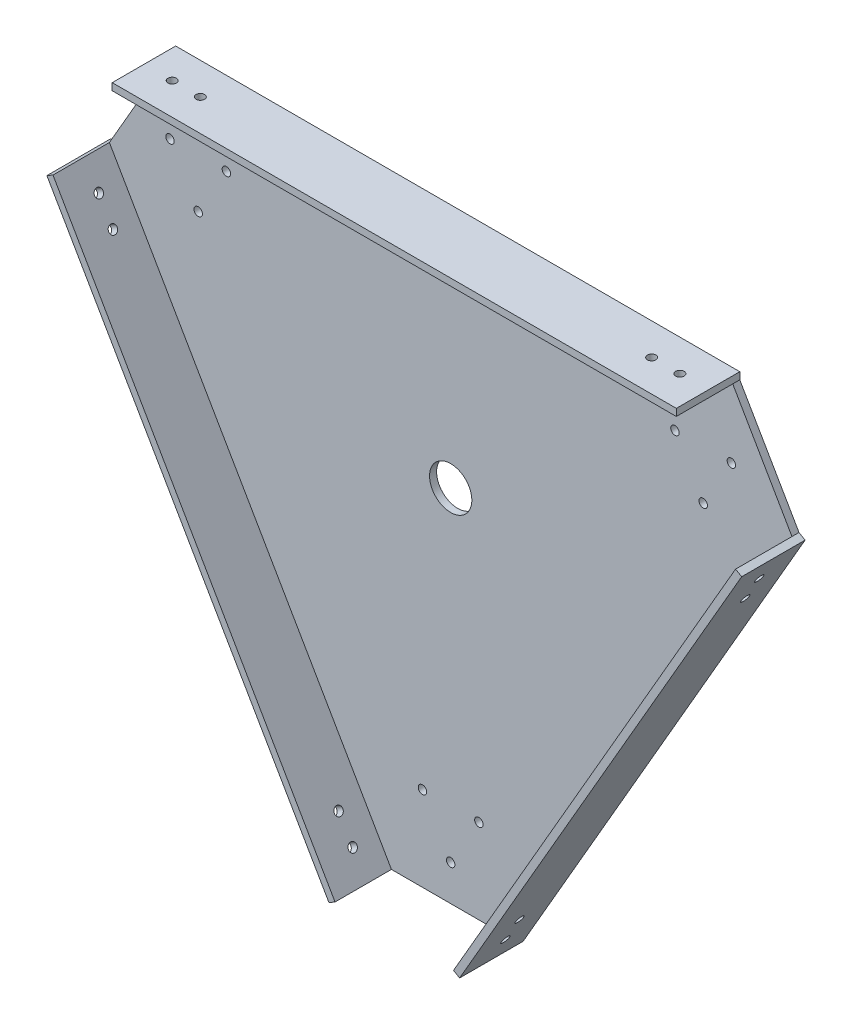
from build123d import *

# Parameters (mm, degrees)
SKETCH_1_R          = 1.5
SKETCH_1_R_2        = 7.5
EXTRUDE_1_DEPTH     = 2.5
SKETCH_2_W          = 200
SKETCH_2_H          = 2.5
EXTRUDE_2_DEPTH     = 22.5
CUT_EXTRUDE_1_REACH = 327.01
SKETCH_3_R          = 1.5
CUT_EXTRUDE_2_REACH = 238.725
SKETCH_6_R          = 1.5
CUT_EXTRUDE_3_REACH = 303.968
SKETCH_7_R          = 1.5


with BuildPart() as part:
    # Эскиз1 → Бобышка-Вытянуть1 (new body)
    with BuildSketch(Plane.XY):
        Polygon((0, 0), (21, 36.373066959), (221, 36.373066959), (242, 0), (142, -173.205080757), (100, -173.205080757), align=None)
        with Locations((21.48120212, 11.846533479)):
            Circle(SKETCH_1_R, mode=Mode.SUBTRACT)
        with Locations((41.48120212, 11.846533479)):
            Circle(SKETCH_1_R, mode=Mode.SUBTRACT)
        with Locations((31.48120212, -5.473974596)):
            Circle(SKETCH_1_R, mode=Mode.SUBTRACT)
        with Locations((200.51879788, 11.846533479)):
            Circle(SKETCH_1_R, mode=Mode.SUBTRACT)
        with Locations((220.51879788, 11.846533479)):
            Circle(SKETCH_1_R, mode=Mode.SUBTRACT)
        with Locations((210.51879788, -5.473974596)):
            Circle(SKETCH_1_R, mode=Mode.SUBTRACT)
        with Locations((111, -143.204572681)):
            Circle(SKETCH_1_R, mode=Mode.SUBTRACT)
        with Locations((131, -143.204572681)):
            Circle(SKETCH_1_R, mode=Mode.SUBTRACT)
        with Locations((121, -160.525080757)):
            Circle(SKETCH_1_R, mode=Mode.SUBTRACT)
        with Locations((121, -45.610671266)):
            Circle(SKETCH_1_R_2, mode=Mode.SUBTRACT)
    extrude(amount=EXTRUDE_1_DEPTH)

    # Эскиз2 → Бобышка-Вытянуть2 (add)
    with BuildSketch(Plane(origin=(0, 0, 0), x_dir=(-1, 0, 0), z_dir=(0, 0, -1))):
        Polygon((0, 0), (2.165063509, -1.25), (-97.834936491, -174.455080757), (-100, -173.205080757), align=None)
        with Locations((-121, 37.623066959)):
            Rectangle(SKETCH_2_W, SKETCH_2_H)
        Polygon((-242, 0), (-244.165063509, -1.25), (-144.165063509, -174.455080757), (-142, -173.205080757), align=None)
    extrude(amount=-EXTRUDE_2_DEPTH)

    # Эскиз3 → Вырез-Вытянуть1 (cut, up to next)
    with BuildSketch(Plane(origin=(0, 38.873066959, 0), x_dir=(1, 0, 0), z_dir=(0, 1, 0)), mode=Mode.PRIVATE) as cut_extrude_1_sk1:
        with Locations(Location((211, -11.25, 0), (0, 0, 180))):
            Circle(SKETCH_3_R)
    cut_extrude_1_tool1 = extrude(cut_extrude_1_sk1.sketch, amount=-CUT_EXTRUDE_1_REACH, mode=Mode.PRIVATE) & part.part
    # Эскиз3 → Вырез-Вытянуть1 (cut, up to next)
    with BuildSketch(Plane(origin=(0, 38.873066959, 0), x_dir=(1, 0, 0), z_dir=(0, 1, 0)), mode=Mode.PRIVATE) as cut_extrude_1_sk2:
        with Locations(Location((201, -11.25, 0), (0, 0, 180))):
            Circle(SKETCH_3_R)
    cut_extrude_1_tool2 = extrude(cut_extrude_1_sk2.sketch, amount=-CUT_EXTRUDE_1_REACH, mode=Mode.PRIVATE) & part.part
    # Эскиз3 → Вырез-Вытянуть1 (cut, up to next)
    with BuildSketch(Plane(origin=(0, 38.873066959, 0), x_dir=(1, 0, 0), z_dir=(0, 1, 0)), mode=Mode.PRIVATE) as cut_extrude_1_sk3:
        with Locations(Location((41, -11.25, 0), (0, 0, 180))):
            Circle(SKETCH_3_R)
    cut_extrude_1_tool3 = extrude(cut_extrude_1_sk3.sketch, amount=-CUT_EXTRUDE_1_REACH, mode=Mode.PRIVATE) & part.part
    # Эскиз3 → Вырез-Вытянуть1 (cut, up to next)
    with BuildSketch(Plane(origin=(0, 38.873066959, 0), x_dir=(1, 0, 0), z_dir=(0, 1, 0)), mode=Mode.PRIVATE) as cut_extrude_1_sk4:
        with Locations(Location((31, -11.25, 0), (0, 0, 180))):
            Circle(SKETCH_3_R)
    cut_extrude_1_tool4 = extrude(cut_extrude_1_sk4.sketch, amount=-CUT_EXTRUDE_1_REACH, mode=Mode.PRIVATE) & part.part
    add(cut_extrude_1_tool1.solids().sort_by_distance((211, 38.873067, 11.25))[0], mode=Mode.SUBTRACT)
    add(cut_extrude_1_tool2.solids().sort_by_distance((201, 38.873067, 11.25))[0], mode=Mode.SUBTRACT)
    add(cut_extrude_1_tool3.solids().sort_by_distance((41, 38.873067, 11.25))[0], mode=Mode.SUBTRACT)
    add(cut_extrude_1_tool4.solids().sort_by_distance((31, 38.873067, 11.25))[0], mode=Mode.SUBTRACT)

    # Эскиз6 → Вырез-Вытянуть2 (cut, up to next)
    with BuildSketch(Plane(origin=(183.665063509, -106.039073858, 0), x_dir=(0, 0, -1), z_dir=(0.8660254037844386, -0.5000000000000003, 0)), mode=Mode.PRIVATE) as cut_extrude_2_sk1:
        with Locations(Location((-11.25, 111, 0), (0, 0, 90))):
            Circle(SKETCH_6_R)
    cut_extrude_2_tool1 = extrude(cut_extrude_2_sk1.sketch, amount=-CUT_EXTRUDE_2_REACH, mode=Mode.PRIVATE) & part.part
    # Эскиз6 → Вырез-Вытянуть2 (cut, up to next)
    with BuildSketch(Plane(origin=(183.665063509, -106.039073858, 0), x_dir=(0, 0, -1), z_dir=(0.8660254037844386, -0.5000000000000003, 0)), mode=Mode.PRIVATE) as cut_extrude_2_sk2:
        with Locations(Location((-11.25, 101, 0), (0, 0, 90))):
            Circle(SKETCH_6_R)
    cut_extrude_2_tool2 = extrude(cut_extrude_2_sk2.sketch, amount=-CUT_EXTRUDE_2_REACH, mode=Mode.PRIVATE) & part.part
    # Эскиз6 → Вырез-Вытянуть2 (cut, up to next)
    with BuildSketch(Plane(origin=(183.665063509, -106.039073858, 0), x_dir=(0, 0, -1), z_dir=(0.8660254037844386, -0.5000000000000003, 0)), mode=Mode.PRIVATE) as cut_extrude_2_sk3:
        with Locations(Location((-11.25, -59, 0), (0, 0, 90))):
            Circle(SKETCH_6_R)
    cut_extrude_2_tool3 = extrude(cut_extrude_2_sk3.sketch, amount=-CUT_EXTRUDE_2_REACH, mode=Mode.PRIVATE) & part.part
    # Эскиз6 → Вырез-Вытянуть2 (cut, up to next)
    with BuildSketch(Plane(origin=(183.665063509, -106.039073858, 0), x_dir=(0, 0, -1), z_dir=(0.8660254037844386, -0.5000000000000003, 0)), mode=Mode.PRIVATE) as cut_extrude_2_sk4:
        with Locations(Location((-11.25, -69, 0), (0, 0, 90))):
            Circle(SKETCH_6_R)
    cut_extrude_2_tool4 = extrude(cut_extrude_2_sk4.sketch, amount=-CUT_EXTRUDE_2_REACH, mode=Mode.PRIVATE) & part.part
    add(cut_extrude_2_tool1.solids().sort_by_distance((239.165064, -9.910254, 11.25))[0], mode=Mode.SUBTRACT)
    add(cut_extrude_2_tool2.solids().sort_by_distance((234.165064, -18.570508, 11.25))[0], mode=Mode.SUBTRACT)
    add(cut_extrude_2_tool3.solids().sort_by_distance((154.165064, -157.134573, 11.25))[0], mode=Mode.SUBTRACT)
    add(cut_extrude_2_tool4.solids().sort_by_distance((149.165064, -165.794827, 11.25))[0], mode=Mode.SUBTRACT)

    # Эскиз7 → Вырез-Вытянуть3 (cut, up to next)
    with BuildSketch(Plane(origin=(-2.165063509, -1.25, 0), x_dir=(0, 0, 1), z_dir=(-0.8660254037844386, -0.5000000000000003, 0)), mode=Mode.PRIVATE) as cut_extrude_3_sk1:
        with Locations(Location((11.25, -10, 0), (0, 0, 270))):
            Circle(SKETCH_7_R)
    cut_extrude_3_tool1 = extrude(cut_extrude_3_sk1.sketch, amount=-CUT_EXTRUDE_3_REACH, mode=Mode.PRIVATE) & part.part
    # Эскиз7 → Вырез-Вытянуть3 (cut, up to next)
    with BuildSketch(Plane(origin=(-2.165063509, -1.25, 0), x_dir=(0, 0, 1), z_dir=(-0.8660254037844386, -0.5000000000000003, 0)), mode=Mode.PRIVATE) as cut_extrude_3_sk2:
        with Locations(Location((11.25, -20, 0), (0, 0, 270))):
            Circle(SKETCH_7_R)
    cut_extrude_3_tool2 = extrude(cut_extrude_3_sk2.sketch, amount=-CUT_EXTRUDE_3_REACH, mode=Mode.PRIVATE) & part.part
    # Эскиз7 → Вырез-Вытянуть3 (cut, up to next)
    with BuildSketch(Plane(origin=(-2.165063509, -1.25, 0), x_dir=(0, 0, 1), z_dir=(-0.8660254037844386, -0.5000000000000003, 0)), mode=Mode.PRIVATE) as cut_extrude_3_sk3:
        with Locations(Location((11.25, -180, 0), (0, 0, 270))):
            Circle(SKETCH_7_R)
    cut_extrude_3_tool3 = extrude(cut_extrude_3_sk3.sketch, amount=-CUT_EXTRUDE_3_REACH, mode=Mode.PRIVATE) & part.part
    # Эскиз7 → Вырез-Вытянуть3 (cut, up to next)
    with BuildSketch(Plane(origin=(-2.165063509, -1.25, 0), x_dir=(0, 0, 1), z_dir=(-0.8660254037844386, -0.5000000000000003, 0)), mode=Mode.PRIVATE) as cut_extrude_3_sk4:
        with Locations(Location((11.25, -190, 0), (0, 0, 270))):
            Circle(SKETCH_7_R)
    cut_extrude_3_tool4 = extrude(cut_extrude_3_sk4.sketch, amount=-CUT_EXTRUDE_3_REACH, mode=Mode.PRIVATE) & part.part
    add(cut_extrude_3_tool1.solids().sort_by_distance((2.834936, -9.910254, 11.25))[0], mode=Mode.SUBTRACT)
    add(cut_extrude_3_tool2.solids().sort_by_distance((7.834936, -18.570508, 11.25))[0], mode=Mode.SUBTRACT)
    add(cut_extrude_3_tool3.solids().sort_by_distance((87.834936, -157.134573, 11.25))[0], mode=Mode.SUBTRACT)
    add(cut_extrude_3_tool4.solids().sort_by_distance((92.834936, -165.794827, 11.25))[0], mode=Mode.SUBTRACT)


solid = part.part
